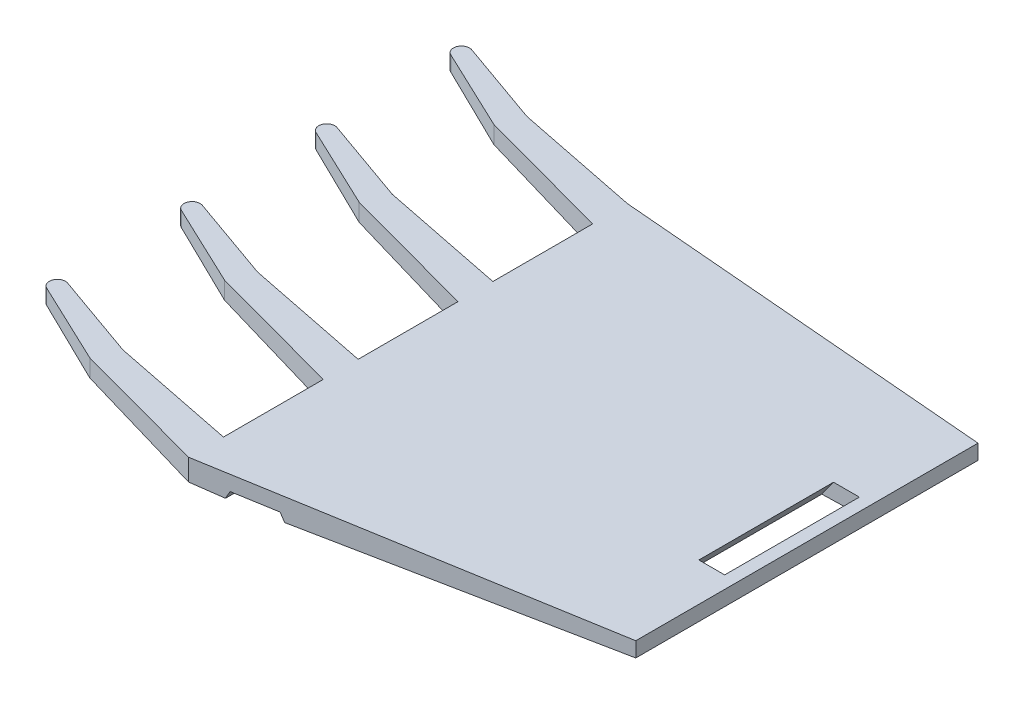
from build123d import *

# Parameters (mm, degrees)
BOSS_EXTRUDE1_START = 28
BOSS_EXTRUDE1_DEPTH = 99.579374
SKETCH1_OUTSIDE_W   = 155.246
SKETCH1_OUTSIDE_H   = 133.053
CUT_EXTRUDE1_DEPTH  = 96.54042058
CUT_EXTRUDE2_START  = -32.303625
CUT_EXTRUDE2_DEPTH  = 27


with BuildPart() as part:
    # Sketch2 → Boss-Extrude1 (new body)
    with BuildSketch(Plane.XY.offset(BOSS_EXTRUDE1_START)):
        Polygon((-58.652152565, -2.957030561), (-7.219837935, -4.5), (-6.431436891, -3), (2.141659611, -3), (2.930060654, -4.5), (63.119847768, -3), (63.119847768, 0), (-58.652152565, 0), align=None)
    extrude(amount=-BOSS_EXTRUDE1_DEPTH)

    # Sketch1 outside → Cut-Extrude1 (cut, through all)
    with BuildSketch(Plane(origin=(0, 0, 0), x_dir=(1, 0, 0), z_dir=(0, 1, 0))):
        with Locations((2.234, 21.7895)):
            Rectangle(SKETCH1_OUTSIDE_W, SKETCH1_OUTSIDE_H)
        with BuildLine():
            Line((-40.711846446, -20.63757447), (-13.556580584, -28))
            Line((-13.556580584, -28), (63.119847768, -15.031886942))
            Line((63.119847768, -15.031886942), (63.119847768, 53.565574166))
            Line((63.119847768, 53.565574166), (-13.556580584, 60))
            Line((-13.556580584, 60), (-38.779919931, 65.060888634))
            Line((-38.779919931, 65.060888634), (-55.906958074, 71.115272488))
            ThreePointArc((-55.906958074, 71.115272488), (-57.932881972, 70.210638871), (-57.133307602, 68.140998698))
            Line((-57.133307602, 68.140998698), (-40.711846446, 60.36242553))
            Line((-40.711846446, 60.36242553), (-13.556580584, 53))
            Line((-13.556580584, 53), (-13.556580584, 33))
            Line((-13.556580584, 33), (-38.779919931, 38.060888634))
            Line((-38.779919931, 38.060888634), (-55.906958074, 44.115272488))
            ThreePointArc((-55.906958074, 44.115272488), (-57.932881972, 43.210638871), (-57.133307602, 41.140998698))
            Line((-57.133307602, 41.140998698), (-40.711846446, 33.36242553))
            Line((-40.711846446, 33.36242553), (-13.556580584, 26))
            Line((-13.556580584, 26), (-13.556580584, 6))
            Line((-13.556580584, 6), (-38.779919931, 11.060888634))
            Line((-38.779919931, 11.060888634), (-55.906958074, 17.115272488))
            ThreePointArc((-55.906958074, 17.115272488), (-57.932881972, 16.210638871), (-57.133307602, 14.140998698))
            Line((-57.133307602, 14.140998698), (-40.711846446, 6.36242553))
            Line((-40.711846446, 6.36242553), (-13.556580584, -1))
            Line((-13.556580584, -1), (-13.556580584, -21))
            Line((-13.556580584, -21), (-38.779919931, -15.939111366))
            Line((-38.779919931, -15.939111366), (-55.906958074, -9.884727512))
            ThreePointArc((-55.906958074, -9.884727512), (-57.932881972, -10.789361129), (-57.133307602, -12.859001302))
            Line((-57.133307602, -12.859001302), (-40.711846446, -20.63757447))
        make_face(mode=Mode.SUBTRACT)
    extrude(amount=-CUT_EXTRUDE1_DEPTH, mode=Mode.SUBTRACT)

    # Sketch3 → Cut-Extrude2 (cut)
    with BuildSketch(Plane.XY.offset(CUT_EXTRUDE2_START)):
        Polygon((60.602138865, 0), (55.427246155, 0), (53.07800672, -3.250254442), (58.455951346, -3.116229762), align=None)
    extrude(amount=CUT_EXTRUDE2_DEPTH, mode=Mode.SUBTRACT)


solid = part.part
